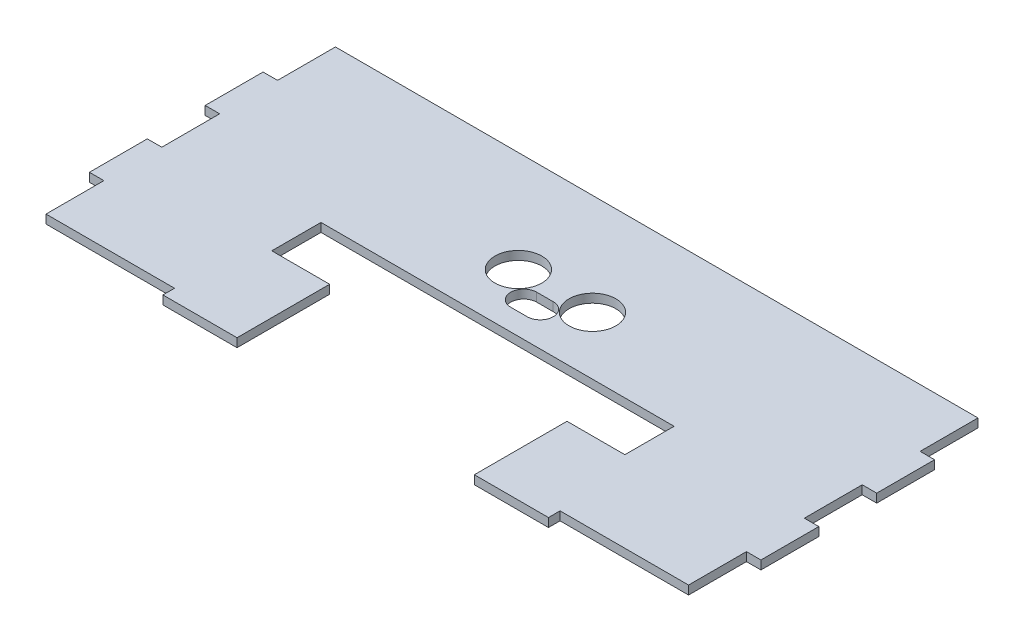
from build123d import *

# Parameters (mm, degrees)
SKETCH1_R           = 8.1
BOSS_EXTRUDE1_DEPTH = 3


with BuildPart() as part:
    # Sketch1 → Boss-Extrude1 (new body)
    with BuildSketch(Plane(origin=(0, 0, 0), x_dir=(1, 0, 0), z_dir=(0, 1, 0))):
        Polygon((-111, 30), (-116, 30), (-116, 10), (-111, 10), (-111, -10), (-116, -10), (-116, -30), (-111, -30), (-111, -50), (-66.6, -50), (-66.6, -54), (-41, -54), (-41, -22), (-61, -22), (-61, -5), (-41, -5), (41, -5), (61, -5), (61, -22), (41, -22), (41, -54), (66.6, -54), (66.6, -50), (111, -50), (111, -30), (116, -30), (116, -10), (111, -10), (111, 10), (116, 10), (116, 30), (111, 30), (111, 50), (-111, 50), align=None)
        with Locations(Location((12.8, 15, 0), (0, 0, 270))):
            Circle(SKETCH1_R, mode=Mode.SUBTRACT)
        with Locations(Location((-12.8, 15, 0), (0, 0, 270))):
            Circle(SKETCH1_R, mode=Mode.SUBTRACT)
        with BuildLine():
            Line((-2.85, 2.4), (2.85, 2.4))
            ThreePointArc((2.85, 2.4), (7.35, 6.9), (2.85, 11.4))
            Line((2.85, 11.4), (-2.85, 11.4))
            ThreePointArc((-2.85, 11.4), (-7.35, 6.9), (-2.85, 2.4))
        make_face(mode=Mode.SUBTRACT)
    extrude(amount=BOSS_EXTRUDE1_DEPTH)


solid = part.part
